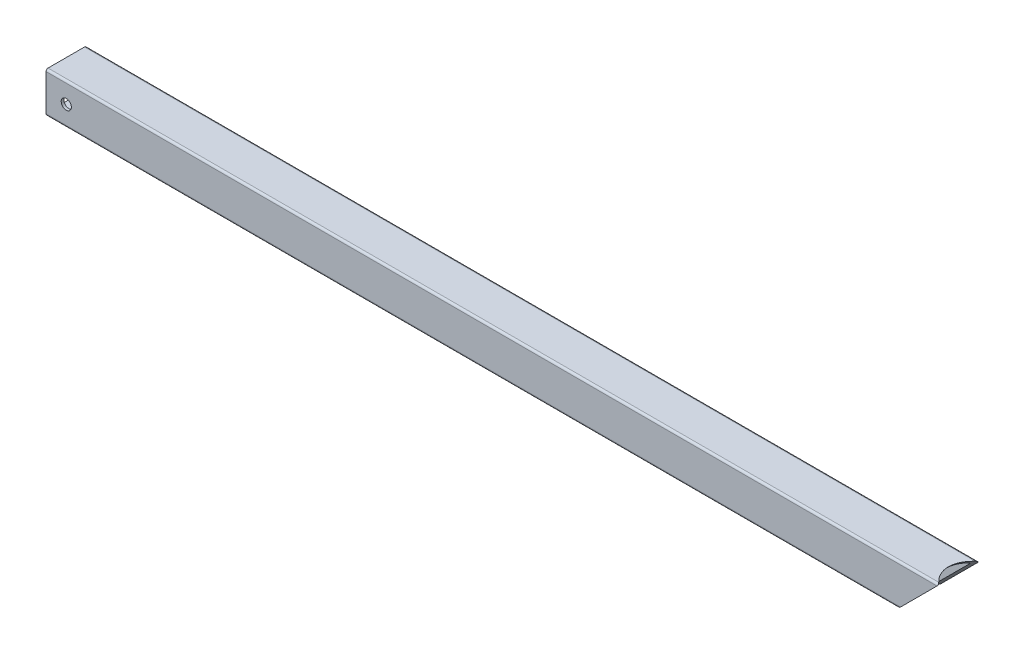
from build123d import *

# Parameters (mm, degrees)
BOSS_EXTRUDE1_DEPTH      = 279.4
BOSS_EXTRUDE1_DEPTH_BACK = 279.4
SKETCH5_R                = 3.175
CUT_EXTRUDE1_DEPTH       = 281.839473721
SKETCH6_R                = 19.05
CUT_EXTRUDE2_DEPTH       = 455.280260412


with BuildPart() as part:
    # Sketch4 → Boss-Extrude1 (new, two sides: drawn at the far end of the back side and taken through both)
    with BuildSketch(Plane(origin=(0, 0, 0), x_dir=(0, 0, -1), z_dir=(1, 0, 0)).offset(-BOSS_EXTRUDE1_DEPTH_BACK)):
        with BuildLine():
            Line((12.7, -11.43), (12.7, 11.43))
            ThreePointArc((12.7, 11.43), (12.328025612, 12.328025612), (11.43, 12.7))
            Line((11.43, 12.7), (-11.43, 12.7))
            ThreePointArc((-11.43, 12.7), (-12.328025612, 12.328025612), (-12.7, 11.43))
            Line((-12.7, 11.43), (-12.7, -11.43))
            ThreePointArc((-12.7, -11.43), (-12.328025612, -12.328025612), (-11.43, -12.7))
            Line((-11.43, -12.7), (11.43, -12.7))
            ThreePointArc((11.43, -12.7), (12.328025612, -12.328025612), (12.7, -11.43))
        make_face()
        with BuildLine():
            Line((11.049, 9.9441), (11.049, -9.9441))
            ThreePointArc((11.049, -9.9441), (10.725382283, -10.725382283), (9.9441, -11.049))
            Line((9.9441, -11.049), (-9.9441, -11.049))
            ThreePointArc((-9.9441, -11.049), (-10.725382283, -10.725382283), (-11.049, -9.9441))
            Line((-11.049, -9.9441), (-11.049, 9.9441))
            ThreePointArc((-11.049, 9.9441), (-10.725382283, 10.725382283), (-9.9441, 11.049))
            Line((-9.9441, 11.049), (9.9441, 11.049))
            ThreePointArc((9.9441, 11.049), (10.725382283, 10.725382283), (11.049, 9.9441))
        make_face(mode=Mode.SUBTRACT)
    extrude(amount=BOSS_EXTRUDE1_DEPTH + BOSS_EXTRUDE1_DEPTH_BACK)

    # Sketch5 → Cut-Extrude1 (cut, through all)
    with BuildSketch(Plane.XY.offset(12.7)):
        with Locations((-266.7, 0)):
            Circle(SKETCH5_R)
    extrude(amount=-CUT_EXTRUDE1_DEPTH, mode=Mode.SUBTRACT)

    # Sketch6 → Cut-Extrude2 (cut, through all)
    with BuildSketch(Plane(origin=(146.05, 146.05, 0), x_dir=(0, 0, 1), z_dir=(0.7071067811865464, 0.7071067811865488, 0))):
        with Locations((0, 203.243890785)):
            Circle(SKETCH6_R)
    extrude(amount=-CUT_EXTRUDE2_DEPTH, mode=Mode.SUBTRACT)


solid = part.part
